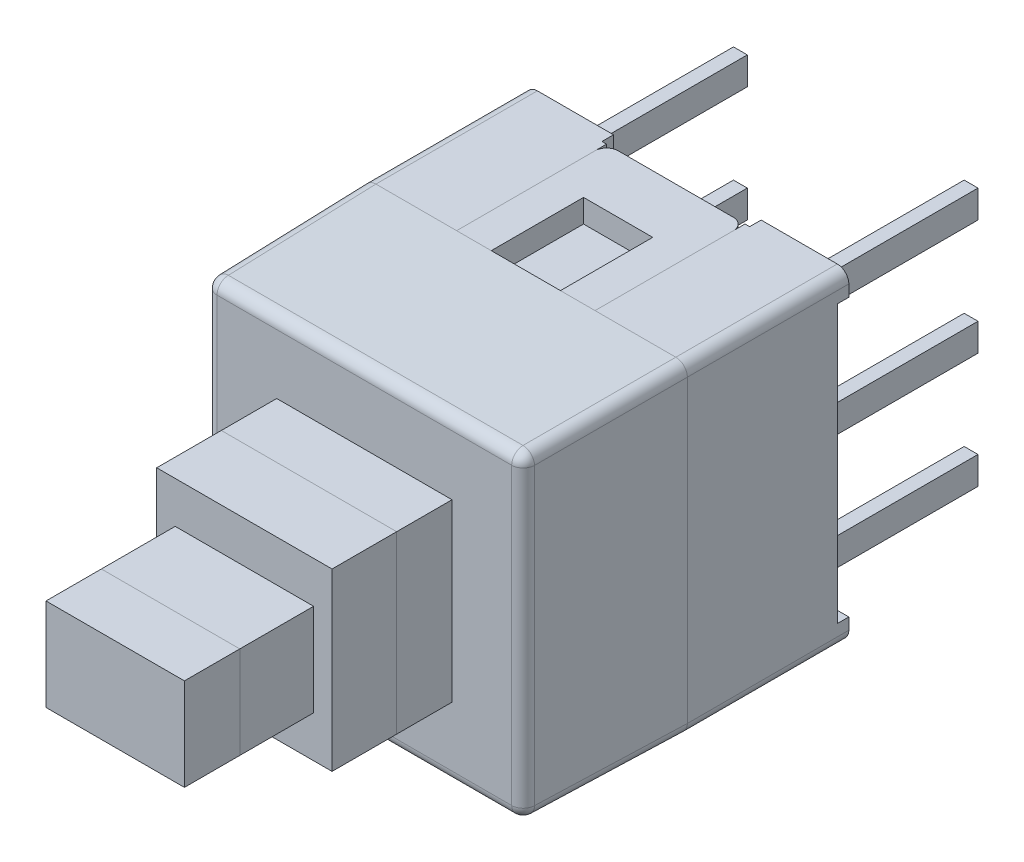
from build123d import *

# Parameters (mm, degrees)
ESQUISSE1_W             = 7
ESQUISSE1_H             = 7
BOSS_EXTRU_1_DEPTH      = 3.5
ENL_V_MAT_EXTRU_1_DEPTH = 0.25
ESQUISSE3_W             = 3
ESQUISSE3_H             = 3.25
ENL_V_MAT_EXTRU_2_DEPTH = 0.5
ENL_V_START             = -7
ESQUISSE3_2_W           = 3
ESQUISSE3_2_H           = 3.25
ENL_V_MAT_EXTRU_3_DEPTH = 0.5
ESQUISSE4_W             = 7
ESQUISSE4_H             = 7
BOSS_EXTRU_2_DEPTH      = 3.5
BOSS_EXTRU_2_TAPER      = 1
ESQUISSE5_W             = 3
ESQUISSE5_H             = 0.5
BOSS_EXTRU_3_DEPTH      = 3.25
ESQUISSE8_W             = 1.5
ESQUISSE8_H             = 2
ENL_V_MAT_EXTRU_4_DEPTH = 9.5732141
ESQUISSE8_3_W           = 0.6
ESQUISSE8_3_H           = 2
ENL_V_MAT_EXTRU_5_DEPTH = 9.5732141
CONG_1_R                = 0.25
CONG_2_R                = 0.25
CONG_3_R                = 0.25
CONG_4_R                = 0.25
ESQUISSE6_W             = 3.8
ESQUISSE6_H             = 3.8
BOSS_EXTRU_4_DEPTH      = 1.2
BOSS_EXTRU_5_START      = 1.2
ESQUISSE6_3_W           = 3.8
ESQUISSE6_3_H           = 3.8
BOSS_EXTRU_5_DEPTH      = 1.4
BOSS_EXTRU_6_DEPTH      = 1.6
BOSS_EXTRU_6_DEPTH_BACK = 2.6
ESQUISSE7_W             = 3
ESQUISSE7_H             = 2
BOSS_EXTRU_7_START      = 1.6
ESQUISSE7_2_W           = 3
ESQUISSE7_2_H           = 2
BOSS_EXTRU_7_DEPTH      = 1.2
ESQUISSE9_W             = 0.3
ESQUISSE9_H             = 0.6
BOSS_EXTRU_8_DEPTH      = 3.9
BOSS_EXTRU_8_2_DEPTH    = 3.9
BOSS_EXTRU_8_3_DEPTH    = 3.9
BOSS_EXTRU_8_4_DEPTH    = 3.9
BOSS_EXTRU_8_5_DEPTH    = 3.9
BOSS_EXTRU_8_6_DEPTH    = 3.9


with BuildPart() as part:
    # Esquisse1 → Boss.-Extru.1 (new body)
    with BuildSketch(Plane.XY):
        Rectangle(ESQUISSE1_W, ESQUISSE1_H)
    extrude(amount=BOSS_EXTRU_1_DEPTH)

    # Esquisse2 → Enlèv. mat.-Extru.1 (cut)
    with BuildSketch(Plane(origin=(0, 0, 0), x_dir=(-1, 0, 0), z_dir=(0, 0, -1))):
        Polygon((1.6, 3.5), (-1.6, 3.5), (-1.6, 3), (-3.5, 3), (-3.5, -3), (-1.6, -3), (-1.6, -3.5), (1.6, -3.5), (1.6, -3), (3.5, -3), (3.5, 3), (1.6, 3), align=None)
    extrude(amount=-ENL_V_MAT_EXTRU_1_DEPTH, mode=Mode.SUBTRACT)

    # Esquisse3 → Enlèv. mat.-Extru.2 (cut)
    with BuildSketch(Plane(origin=(0, 3.5, 0), x_dir=(1, 0, 0), z_dir=(0, 1, 0))):
        with Locations((0, -1.875)):
            Rectangle(ESQUISSE3_W, ESQUISSE3_H)
    extrude(amount=-ENL_V_MAT_EXTRU_2_DEPTH, mode=Mode.SUBTRACT)

    # Esquisse3<2> → Enlèv. mat.-Extru.3 (cut)
    with BuildSketch(Plane(origin=(0, 3.5, 0), x_dir=(1, 0, 0), z_dir=(0, 1, 0)).offset(ENL_V_START)):
        with Locations((0, -1.875)):
            Rectangle(ESQUISSE3_2_W, ESQUISSE3_2_H)
    extrude(amount=ENL_V_MAT_EXTRU_3_DEPTH, mode=Mode.SUBTRACT)

    # Congé1
    cong_1_edges = [part.edges().sort_by_distance(p)[0] for p in [
        (3.5, -3.5, 1.75),
        (-3.5, -3.5, 1.75),
        (-3.5, 3.5, 1.75),
        (3.5, 3.5, 1.75),
    ]]
    fillet(cong_1_edges, radius=CONG_1_R)


with BuildPart() as body_2:
    # Esquisse4 → Boss.-Extru.2 (new body)
    with BuildSketch(Plane.XY.offset(3.5)):
        Rectangle(ESQUISSE4_W, ESQUISSE4_H)
    extrude(amount=BOSS_EXTRU_2_DEPTH, taper=BOSS_EXTRU_2_TAPER)

    # Esquisse5 → Boss.-Extru.3 (add)
    with BuildSketch(Plane(origin=(0, 0, 3.5), x_dir=(-1, 0, 0), z_dir=(0, 0, -1))):
        with Locations((0, 3.25)):
            Rectangle(ESQUISSE5_W, ESQUISSE5_H)
        with Locations((0, -3.25)):
            Rectangle(ESQUISSE5_W, ESQUISSE5_H)
    extrude(amount=BOSS_EXTRU_3_DEPTH)

    # Esquisse8 → Enlèv. mat.-Extru.4 (cut, through all)
    with BuildSketch(Plane(origin=(0, 0, 0), x_dir=(1, 0, 0), z_dir=(0, 1, 0))):
        with Locations((0, -2.5)):
            Rectangle(ESQUISSE8_W, ESQUISSE8_H)
    extrude(amount=ENL_V_MAT_EXTRU_4_DEPTH, mode=Mode.SUBTRACT)

    # Esquisse8<3> → Enlèv. mat.-Extru.5 (cut, through all)
    with BuildSketch(Plane(origin=(0, 0, 0), x_dir=(1, 0, 0), z_dir=(0, 1, 0))):
        with Locations((0.45, -2.5)):
            Rectangle(ESQUISSE8_3_W, ESQUISSE8_3_H)
        with Locations((-0.45, -2.5)):
            Rectangle(ESQUISSE8_3_W, ESQUISSE8_3_H)
    extrude(amount=-ENL_V_MAT_EXTRU_5_DEPTH, mode=Mode.SUBTRACT)

    # Congé2
    cong_2_edges = [body_2.edges().sort_by_distance(p)[0] for p in [
        (-3.469453636, 3.469453636, 5.25),
        (3.469453636, 3.469453636, 5.25),
        (3.469453636, -3.469453636, 5.25),
        (-3.469453636, -3.469453636, 5.25),
    ]]
    fillet(cong_2_edges, radius=CONG_2_R)

    # Congé3
    cong_3_edges = [body_2.edges().sort_by_distance(p)[0] for p in [
        (0, 3.438907273, 7),
        (3.438907273, 0, 7),
        (-3.438907273, 0, 7),
        (0, -3.438907273, 7),
        (-3.365699738, 3.365699738, 7),
        (-3.365699738, -3.365699738, 7),
        (3.365699738, -3.365699738, 7),
        (3.365699738, 3.365699738, 7),
    ]]
    fillet(cong_3_edges, radius=CONG_3_R)

    # Congé4
    cong_4_edges = [body_2.edges().sort_by_distance(p)[0] for p in [
        (1.5, 3.25, 0.25),
        (-1.5, 3.25, 0.25),
        (1.5, -3.25, 0.25),
        (-1.5, -3.25, 0.25),
    ]]
    fillet(cong_4_edges, radius=CONG_4_R)


with BuildPart() as body_3:
    # Esquisse6 → Boss.-Extru.4 (new body)
    with BuildSketch(Plane.XY.offset(7)):
        Rectangle(ESQUISSE6_W, ESQUISSE6_H)
    extrude(amount=BOSS_EXTRU_4_DEPTH)


with BuildPart() as body_4:
    # Esquisse6<3> → Boss.-Extru.5 (new body)
    with BuildSketch(Plane.XY.offset(7).offset(BOSS_EXTRU_5_START)):
        Rectangle(ESQUISSE6_3_W, ESQUISSE6_3_H)
    extrude(amount=BOSS_EXTRU_5_DEPTH)


with BuildPart() as body_5:
    # Esquisse7 → Boss.-Extru.6 (new, two sides: drawn at the far end of the back side and taken through both)
    with BuildSketch(Plane.XY.offset(9.6).offset(-BOSS_EXTRU_6_DEPTH_BACK)):
        Rectangle(ESQUISSE7_W, ESQUISSE7_H)
    extrude(amount=BOSS_EXTRU_6_DEPTH + BOSS_EXTRU_6_DEPTH_BACK)


with BuildPart() as body_6:
    # Esquisse7<2> → Boss.-Extru.7 (new body)
    with BuildSketch(Plane.XY.offset(9.6).offset(BOSS_EXTRU_7_START)):
        Rectangle(ESQUISSE7_2_W, ESQUISSE7_2_H)
    extrude(amount=BOSS_EXTRU_7_DEPTH)


with BuildPart() as body_7:
    # Esquisse9 → Boss.-Extru.8 (new body)
    with BuildSketch(Plane(origin=(0, 0, 0.25), x_dir=(-1, 0, 0), z_dir=(0, 0, -1))):
        with Locations((2.5, -2.5)):
            Rectangle(ESQUISSE9_W, ESQUISSE9_H)
    extrude(amount=BOSS_EXTRU_8_DEPTH)


with BuildPart() as body_8:
    # Esquisse9 → Boss.-Extru.8 2 (new body)
    with BuildSketch(Plane(origin=(0, 0, 0.25), x_dir=(-1, 0, 0), z_dir=(0, 0, -1))):
        with Locations((2.5, 0)):
            Rectangle(ESQUISSE9_W, ESQUISSE9_H)
    extrude(amount=BOSS_EXTRU_8_2_DEPTH)


with BuildPart() as body_9:
    # Esquisse9 → Boss.-Extru.8 3 (new body)
    with BuildSketch(Plane(origin=(0, 0, 0.25), x_dir=(-1, 0, 0), z_dir=(0, 0, -1))):
        with Locations((2.5, 2.5)):
            Rectangle(ESQUISSE9_W, ESQUISSE9_H)
    extrude(amount=BOSS_EXTRU_8_3_DEPTH)


with BuildPart() as body_10:
    # Esquisse9 → Boss.-Extru.8 4 (new body)
    with BuildSketch(Plane(origin=(0, 0, 0.25), x_dir=(-1, 0, 0), z_dir=(0, 0, -1))):
        with Locations((-2.5, 2.5)):
            Rectangle(ESQUISSE9_W, ESQUISSE9_H)
    extrude(amount=BOSS_EXTRU_8_4_DEPTH)


with BuildPart() as body_11:
    # Esquisse9 → Boss.-Extru.8 5 (new body)
    with BuildSketch(Plane(origin=(0, 0, 0.25), x_dir=(-1, 0, 0), z_dir=(0, 0, -1))):
        with Locations((-2.5, 0)):
            Rectangle(ESQUISSE9_W, ESQUISSE9_H)
    extrude(amount=BOSS_EXTRU_8_5_DEPTH)


with BuildPart() as body_12:
    # Esquisse9 → Boss.-Extru.8 6 (new body)
    with BuildSketch(Plane(origin=(0, 0, 0.25), x_dir=(-1, 0, 0), z_dir=(0, 0, -1))):
        with Locations((-2.5, -2.5)):
            Rectangle(ESQUISSE9_W, ESQUISSE9_H)
    extrude(amount=BOSS_EXTRU_8_6_DEPTH)


solid = Compound([part.part, body_2.part, body_3.part, body_4.part, body_5.part, body_6.part, body_7.part, body_8.part, body_9.part, body_10.part, body_11.part, body_12.part])
